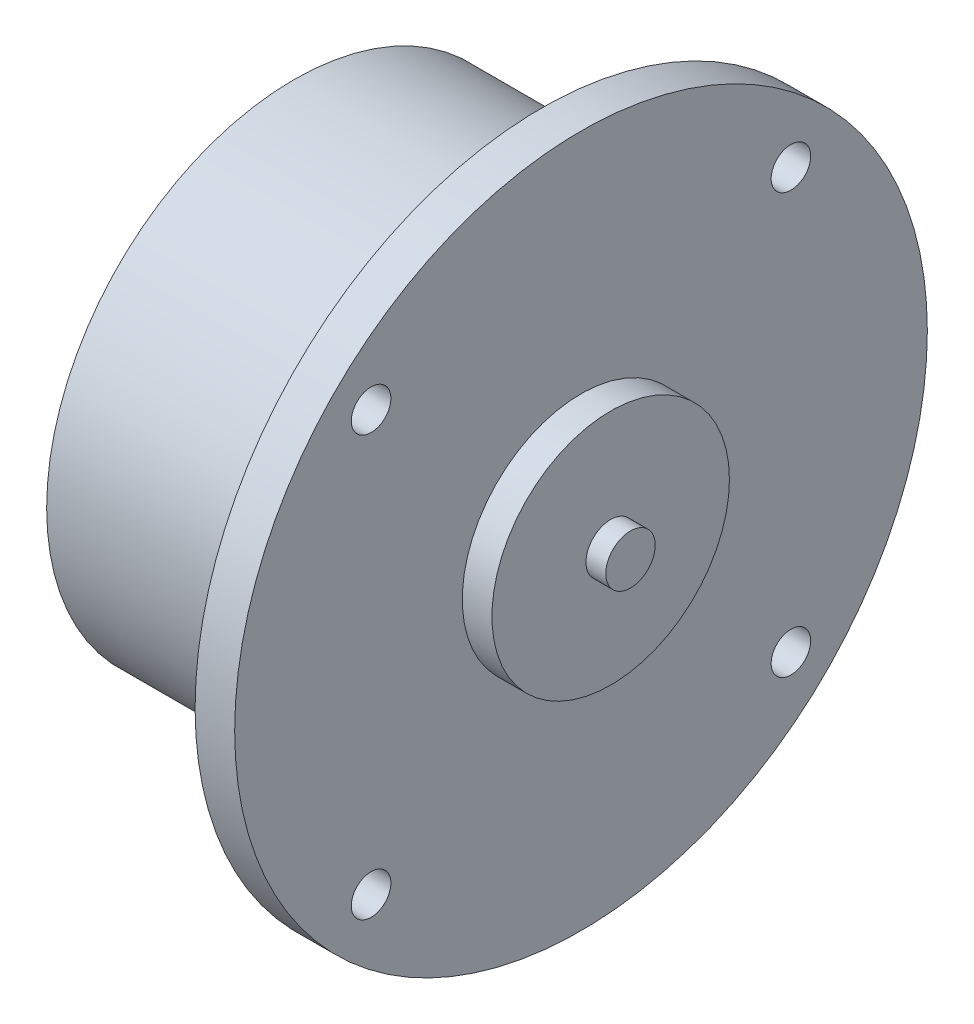
from build123d import *

# Parameters (mm, degrees)
SKETCH_1_R          = 35
SKETCH_1_R_2        = 2
EXTRUDE_1_DEPTH     = 4
SKETCH_2_R          = 12
EXTRUDE_2_DEPTH     = 3
SKETCH_3_R          = 2.5
EXTRUDE_3_DEPTH     = 2
SKETCH_4_R          = 25
EXTRUDE_4_DEPTH     = 25
EXTRUDE_START       = 11
SKETCH_5_R          = 2.5
EXTRUDE_5_DEPTH     = 11
CUT_EXTRUDE_1_DEPTH = 11


with BuildPart() as part:
    # 草图1 → 凸台-拉伸1 (new body)
    with BuildSketch(Plane(origin=(0, 0, 0), x_dir=(0, 0, -1), z_dir=(1, 0, 0))):
        Circle(SKETCH_1_R)
        with Locations((21.213203436, 21.213203436)):
            Circle(SKETCH_1_R_2, mode=Mode.SUBTRACT)
        with Locations((-21.213203436, 21.213203436)):
            Circle(SKETCH_1_R_2, mode=Mode.SUBTRACT)
        with Locations((-21.213203436, -21.213203436)):
            Circle(SKETCH_1_R_2, mode=Mode.SUBTRACT)
        with Locations((21.213203436, -21.213203436)):
            Circle(SKETCH_1_R_2, mode=Mode.SUBTRACT)
    extrude(amount=EXTRUDE_1_DEPTH)

    # 草图2 → 凸台-拉伸2 (add)
    with BuildSketch(Plane(origin=(4, 0, 0), x_dir=(0, 0, -1), z_dir=(1, 0, 0))):
        Circle(SKETCH_2_R)
    extrude(amount=EXTRUDE_2_DEPTH)

    # 草图3 → 凸台-拉伸3 (add)
    with BuildSketch(Plane(origin=(7, 0, 0), x_dir=(0, 0, -1), z_dir=(1, 0, 0))):
        Circle(SKETCH_3_R)
    extrude(amount=EXTRUDE_3_DEPTH)

    # 草图4 → 凸台-拉伸4 (add)
    with BuildSketch(Plane.ZY):
        Circle(SKETCH_4_R)
    extrude(amount=EXTRUDE_4_DEPTH)

    # 草图5 → 凸台-拉伸5 (add)
    with BuildSketch(Plane.ZY.offset(25).offset(EXTRUDE_START)):
        with Locations(Location((0, 0, 0), (0, 0, 180))):
            Circle(SKETCH_5_R)
    extrude(amount=-EXTRUDE_5_DEPTH)

    # 草图6 → 切除-拉伸1 (cut)
    with BuildSketch(Plane.ZY.offset(36)):
        Polygon((1.5, -2), (-1.5, -2), (-1.5, -3.83926129), (2.04191787, -3.83926129), align=None)
    extrude(amount=-CUT_EXTRUDE_1_DEPTH, mode=Mode.SUBTRACT)


solid = part.part
